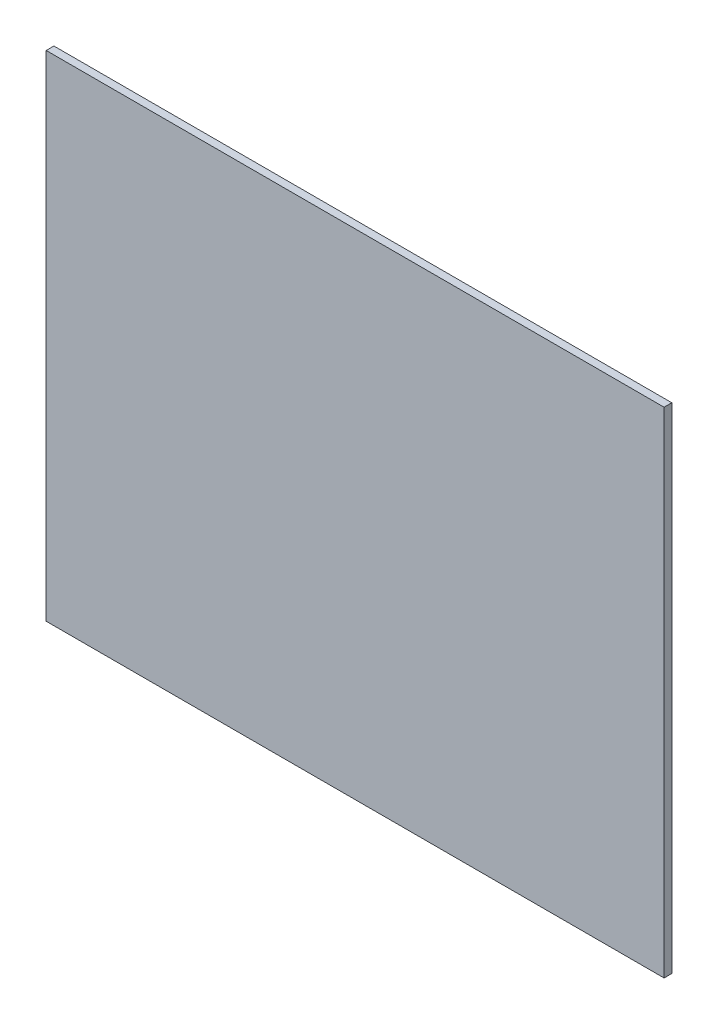
from build123d import *

# Parameters (mm, degrees)
SKETCH1_W           = 254
SKETCH1_H           = 203.2
BOSS_EXTRUDE2_DEPTH = 3.175


with BuildPart() as part:
    # Sketch1 → Boss-Extrude2 (new body)
    with BuildSketch(Plane.XY):
        with Locations((127, 101.6)):
            Rectangle(SKETCH1_W, SKETCH1_H)
    extrude(amount=BOSS_EXTRUDE2_DEPTH)


solid = part.part
